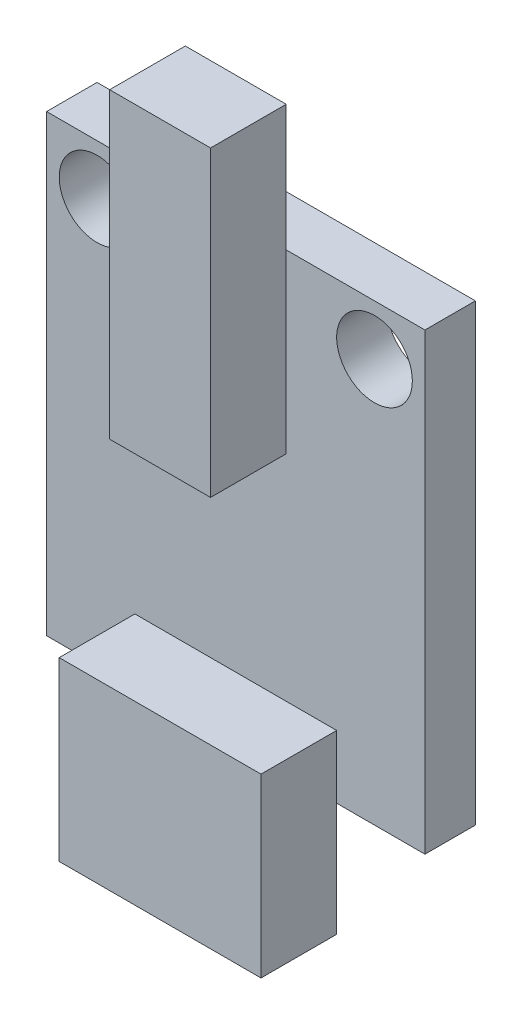
from build123d import *

# Parameters (mm, degrees)
CROQUIS1_W              = 15
CROQUIS1_H              = 18
SALIENTE_EXTRUIR1_DEPTH = 2
CROQUIS2_R              = 1.5
CORTAR_EXTRUIR1_DEPTH   = 12.884864324
CROQUIS3_W              = 4
CROQUIS3_H              = 12
SALIENTE_EXTRUIR2_DEPTH = 3
CROQUIS4_W              = 8
CROQUIS4_H              = 7
SALIENTE_EXTRUIR3_DEPTH = 3


with BuildPart() as part:
    # Croquis1 → Saliente-Extruir1 (new body)
    with BuildSketch(Plane.XY):
        Rectangle(CROQUIS1_W, CROQUIS1_H)
    extrude(amount=SALIENTE_EXTRUIR1_DEPTH)

    # Croquis2 → Cortar-Extruir1 (cut, through all)
    with BuildSketch(Plane.XY.offset(2)):
        with Locations((-5.5, 7)):
            Circle(CROQUIS2_R)
        with Locations((5.5, 7)):
            Circle(CROQUIS2_R)
    extrude(amount=-CORTAR_EXTRUIR1_DEPTH, mode=Mode.SUBTRACT)

    # Croquis3 → Saliente-Extruir2 (add)
    with BuildSketch(Plane.XY.offset(2)):
        with Locations((0, 8)):
            Rectangle(CROQUIS3_W, CROQUIS3_H)
    extrude(amount=SALIENTE_EXTRUIR2_DEPTH)

    # Croquis4 → Saliente-Extruir3 (add)
    with BuildSketch(Plane.XY.offset(2)):
        with Locations((0, -10)):
            Rectangle(CROQUIS4_W, CROQUIS4_H)
    extrude(amount=SALIENTE_EXTRUIR3_DEPTH)


solid = part.part
